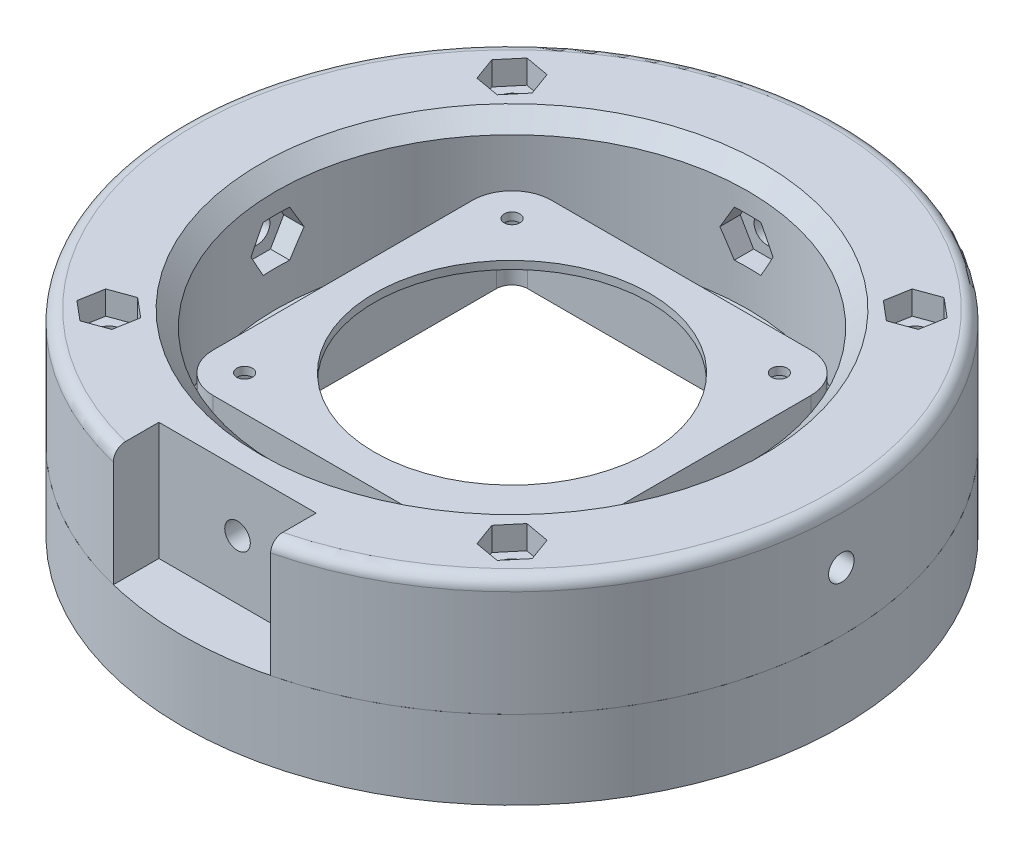
from build123d import *

# Parameters (mm, degrees)
SKETCH1_R               = 41.9
TOP_PART_DEPTH          = 15
SKETCH2_R               = 30
CUT_EXTRUDE1_DEPTH      = 20
FILLET1_R               = 1.5
CHAMFER1_SIZE           = 2
SKETCH8_7_R             = 1.625
CUT_EXTRUDE8_DEPTH      = 3
SKETCH8_R               = 1.625
CUT_EXTRUDE7_DEPTH      = 62.124626857
CUT_EXTRUDE11_DEPTH     = 62.124626857
SKETCH15_R              = 1.625
CUT_EXTRUDE14_DEPTH     = 10
CUT_EXTRUDE15_DEPTH     = 10
CIRPATTERN1_COUNT       = 4
CIRPATTERN2_COUNT       = 4
SKETCH3_R               = 41.9
BOTTOM_PART_DEPTH       = 20
SKETCH6_R               = 37.9
CUT_EXTRUDE3_DEPTH      = 63.076324134
SKETCH_1_W              = 43
SKETCH_1_H              = 43
EXTRUDE_1_DEPTH         = 8
FILLET_1_R              = 5
CUT_EXTRUDE4_DEPTH      = 63.076324134
CUT_EXTRUDE4_DEPTH_BACK = 63.076324134
SKETCH7_R               = 17.5
SKETCH7_R_2             = 1
SKETCH12_W              = 39.5
SKETCH12_H              = 39.5
CUT_EXTRUDE10_DEPTH     = 8.5
FILLET3_R               = 2
SKETCH17_R              = 1.625
CUT_EXTRUDE16_DEPTH     = 63.076324134
SKETCH18_R              = 3
CUT_EXTRUDE17_DEPTH     = 63.076324134
SKETCH19_R              = 2.75
BOSS_EXTRUDE1_DEPTH     = 18.5
SKETCH20_W              = 87.79908129
SKETCH20_H              = 93.09964502
CUT_EXTRUDE18_DEPTH     = 10
SKETCH21_W              = 20
SKETCH21_H              = 8.651798588
CUT_EXTRUDE19_DEPTH     = 15


with BuildPart() as part:
    # Sketch1 → Top-Part (new body)
    with BuildSketch(Plane(origin=(0, 0, 0), x_dir=(1, 0, 0), z_dir=(0, 1, 0))):
        with Locations(Location((0, 0, 0), (0, 0, 270))):
            Circle(SKETCH1_R)
    extrude(amount=TOP_PART_DEPTH)

    # Sketch2 → Cut-Extrude1 (cut)
    with BuildSketch(Plane(origin=(0, 15, 0), x_dir=(1, 0, 0), z_dir=(0, 1, 0))):
        with Locations(Location((0, 0, 0), (0, 0, 270))):
            Circle(SKETCH2_R)
    extrude(amount=-CUT_EXTRUDE1_DEPTH, mode=Mode.SUBTRACT)

    # Fillet1
    fillet1_edges = [part.edges().sort_by_distance(p)[0] for p in [
        (0, 15, -41.9),
    ]]
    fillet(fillet1_edges, radius=FILLET1_R)

    # Chamfer1
    chamfer1_edges = [part.edges().sort_by_distance(p)[0] for p in [
        (0, 15, -30),
    ]]
    chamfer(chamfer1_edges, length=CHAMFER1_SIZE)

    # Sketch8<7> → Cut-Extrude8 (cut)
    # profile 1 of 4: a face of its own
    with BuildSketch(Plane(origin=(0, 15, 0), x_dir=(1, 0, 0), z_dir=(0, 1, 0))):
        Polygon((25.083213555, 22.516777398), (28.056316743, 23.598898462), (28.605724005, 26.714741882), (26.182028081, 28.748464238), (23.208924893, 27.666343174), (22.659517631, 24.550499754), align=None)
        with Locations(Location((25.632620818, 25.632620818, 0), (0, 0, 270))):
            Circle(SKETCH8_7_R, mode=Mode.SUBTRACT)
    # profile 2 of 4: a face of its own
    with BuildSketch(Plane(origin=(0, 15, 0), x_dir=(1, 0, 0), z_dir=(0, 1, 0))):
        Polygon((-22.516777398, 25.083213555), (-23.598898462, 28.056316743), (-26.714741882, 28.605724005), (-28.748464238, 26.182028081), (-27.666343174, 23.208924893), (-24.550499754, 22.659517631), align=None)
        with Locations(Location((-25.632620818, 25.632620818, 0), (0, 0, 270))):
            Circle(SKETCH8_7_R, mode=Mode.SUBTRACT)
    # profile 3 of 4: a face of its own
    with BuildSketch(Plane(origin=(0, 15, 0), x_dir=(1, 0, 0), z_dir=(0, 1, 0))):
        Polygon((22.516777398, -25.083213555), (23.598898462, -28.056316743), (26.714741882, -28.605724005), (28.748464238, -26.182028081), (27.666343174, -23.208924893), (24.550499754, -22.659517631), align=None)
        with Locations(Location((25.632620818, -25.632620818, 0), (0, 0, 270))):
            Circle(SKETCH8_7_R, mode=Mode.SUBTRACT)
    # profile 4 of 4: a face of its own
    with BuildSketch(Plane(origin=(0, 15, 0), x_dir=(1, 0, 0), z_dir=(0, 1, 0))):
        Polygon((-25.083213555, -22.516777398), (-28.056316743, -23.598898462), (-28.605724005, -26.714741882), (-26.182028081, -28.748464238), (-23.208924893, -27.666343174), (-22.659517631, -24.550499754), align=None)
        with Locations(Location((-25.632620818, -25.632620818, 0), (0, 0, 270))):
            Circle(SKETCH8_7_R, mode=Mode.SUBTRACT)
    extrude(amount=-CUT_EXTRUDE8_DEPTH, mode=Mode.SUBTRACT)

    # Sketch8 → Cut-Extrude7 (cut, through all)
    with BuildSketch(Plane(origin=(0, 15, 0), x_dir=(1, 0, 0), z_dir=(0, 1, 0))):
        with Locations(Location((-25.632620818, 25.632620818, 0), (0, 0, 270))):
            Circle(SKETCH8_R)
        with Locations(Location((25.632620818, 25.632620818, 0), (0, 0, 270))):
            Circle(SKETCH8_R)
        with Locations(Location((25.632620818, -25.632620818, 0), (0, 0, 270))):
            Circle(SKETCH8_R)
        with Locations(Location((-25.632620818, -25.632620818, 0), (0, 0, 270))):
            Circle(SKETCH8_R)
    extrude(amount=-CUT_EXTRUDE7_DEPTH, mode=Mode.SUBTRACT)

    # Sketch13 → Cut-Extrude11 (cut, through all)
    with BuildSketch(Plane.XZ):
        with BuildLine():
            Line((-10, 35.519149765), (-10, 40.689187753))
            ThreePointArc((-10, 40.689187753), (0, 41.9), (10, 40.689187753))
            Line((10, 40.689187753), (10, 35.519149765))
            ThreePointArc((10, 35.519149765), (0, 36.9), (-10, 35.519149765))
        make_face()
    extrude(amount=-CUT_EXTRUDE11_DEPTH, mode=Mode.SUBTRACT)

    # Sketch15 → Cut-Extrude14 (cut, symmetric)
    with BuildSketch(Plane.XY.offset(32.4)):
        with Locations(Location((0, 7.5, 0), (0, 0, 180))):
            Circle(SKETCH15_R)
    cut_extrude14 = extrude(amount=CUT_EXTRUDE14_DEPTH, both=True, mode=Mode.SUBTRACT)

    # Sketch16 → Cut-Extrude15 (cut)
    with BuildSketch(Plane.XY.offset(32.4)):
        Polygon((3.377499075, 7.5), (1.688749537, 10.425), (-1.688749537, 10.425), (-3.377499075, 7.5), (-1.688749537, 4.575), (1.688749537, 4.575), align=None)
    cut_extrude15 = extrude(amount=-CUT_EXTRUDE15_DEPTH, mode=Mode.SUBTRACT)

    # CirPattern1: Cut-Extrude14 ×4 about axis
    cirpattern1_axis = Axis((0, 0, 0), (0, 1, 0))
    for i in range(1, CIRPATTERN1_COUNT):
        add(cut_extrude14.rotate(cirpattern1_axis, i * 360 / CIRPATTERN1_COUNT), mode=Mode.SUBTRACT)

    # CirPattern2: Cut-Extrude15 ×4 about axis
    cirpattern2_axis = Axis((0, 0, 0), (0, 1, 0))
    for i in range(1, CIRPATTERN2_COUNT):
        add(cut_extrude15.rotate(cirpattern2_axis, i * 360 / CIRPATTERN2_COUNT), mode=Mode.SUBTRACT)

    # Sketch21 → Cut-Extrude19 (cut)
    with BuildSketch(Plane(origin=(0, 15, 0), x_dir=(1, 0, 0), z_dir=(0, 1, 0))):
        with Locations((0, -39.225899294)):
            Rectangle(SKETCH21_W, SKETCH21_H)
    extrude(amount=-CUT_EXTRUDE19_DEPTH, mode=Mode.SUBTRACT)


with BuildPart() as body_2:
    # Sketch3 → Bottom-Part (new body)
    with BuildSketch(Plane.XZ):
        with Locations(Location((0, 0, 0), (0, 0, 270))):
            Circle(SKETCH3_R)
    extrude(amount=BOTTOM_PART_DEPTH)

    # Sketch6 → Cut-Extrude3 (cut, through all)
    with BuildSketch(Plane(origin=(0, -1.5, 0), x_dir=(1, 0, 0), z_dir=(0, 1, 0))):
        with Locations(Location((0, 0, 0), (0, 0, 270))):
            Circle(SKETCH6_R)
    extrude(amount=-CUT_EXTRUDE3_DEPTH, mode=Mode.SUBTRACT)

    # ｽｹｯﾁ1 → ﾎﾞｽ - 押し出し1 (add)
    with BuildSketch(Plane(origin=(0, 0, 0), x_dir=(1, 0, 0), z_dir=(0, 1, 0))):
        Rectangle(SKETCH_1_W, SKETCH_1_H)
    extrude(amount=EXTRUDE_1_DEPTH)

    # ﾌｨﾚｯﾄ1
    fillet_1_edges = [body_2.edges().sort_by_distance(p)[0] for p in [
        (-21.5, 4, -21.5),
        (-21.5, 4, 21.5),
        (21.5, 4, 21.5),
        (21.5, 4, -21.5),
    ]]
    fillet(fillet_1_edges, radius=FILLET_1_R)

    # Sketch7 → Cut-Extrude4 (cut, two sides: drawn at the far end of the back side and taken through both)
    with BuildSketch(Plane(origin=(0, -1.5, 0), x_dir=(1, 0, 0), z_dir=(0, 1, 0)).offset(-CUT_EXTRUDE4_DEPTH_BACK)):
        with Locations(Location((0, 0, 0), (0, 0, 270))):
            Circle(SKETCH7_R)
        with Locations(Location((17, -17, 0), (0, 0, 270))):
            Circle(SKETCH7_R_2)
        with Locations(Location((-17, -17, 0), (0, 0, 270))):
            Circle(SKETCH7_R_2)
        with Locations(Location((-17, 17, 0), (0, 0, 270))):
            Circle(SKETCH7_R_2)
        with Locations(Location((17, 17, 0), (0, 0, 270))):
            Circle(SKETCH7_R_2)
    extrude(amount=CUT_EXTRUDE4_DEPTH + CUT_EXTRUDE4_DEPTH_BACK, mode=Mode.SUBTRACT)

    # Sketch12 → Cut-Extrude10 (cut)
    with BuildSketch(Plane.XZ.offset(1.5)):
        Rectangle(SKETCH12_W, SKETCH12_H)
    extrude(amount=-CUT_EXTRUDE10_DEPTH, mode=Mode.SUBTRACT)

    # Fillet3
    fillet3_edges = [body_2.edges().sort_by_distance(p)[0] for p in [
        (-19.75, 2.75, -19.75),
        (-19.75, 2.75, 19.75),
        (19.75, 2.75, 19.75),
        (19.75, 2.75, -19.75),
    ]]
    fillet(fillet3_edges, radius=FILLET3_R)

    # Sketch17 → Cut-Extrude16 (cut, through all)
    with BuildSketch(Plane.XZ.offset(1.5)):
        with Locations(Location((25.632620818, -25.632620818, 0), (0, 0, 270))):
            Circle(SKETCH17_R)
        with Locations(Location((-25.632620818, -25.632620818, 0), (0, 0, 270))):
            Circle(SKETCH17_R)
        with Locations(Location((25.632620818, 25.632620818, 0), (0, 0, 270))):
            Circle(SKETCH17_R)
        with Locations(Location((-25.632620818, 25.632620818, 0), (0, 0, 270))):
            Circle(SKETCH17_R)
    extrude(amount=-CUT_EXTRUDE16_DEPTH, mode=Mode.SUBTRACT)

    # Sketch18 → Cut-Extrude17 (cut, through all)
    with BuildSketch(Plane.XZ.offset(1.5)):
        with Locations((-25.632620818, 25.632620818)):
            Circle(SKETCH18_R)
        with Locations((25.632620818, 25.632620818)):
            Circle(SKETCH18_R)
        with Locations((25.632620818, -25.632620818)):
            Circle(SKETCH18_R)
        with Locations((-25.632620818, -25.632620818)):
            Circle(SKETCH18_R)
    extrude(amount=CUT_EXTRUDE17_DEPTH, mode=Mode.SUBTRACT)

    # Sketch19 → Boss-Extrude1 (add)
    # profile 1 of 4: a face of its own
    with BuildSketch(Plane.XZ.offset(1.5)):
        with BuildLine():
            Line((-6, 33), (-6, 37.422052322))
            ThreePointArc((-6, 37.422052322), (0, 37.9), (6, 37.422052322))
            Line((6, 37.422052322), (6, 33))
            ThreePointArc((6, 33), (0, 27), (-6, 33))
        make_face()
        with Locations(Location((0, 33, 0), (0, 0, 270))):
            Circle(SKETCH19_R, mode=Mode.SUBTRACT)
    # profile 2 of 4: a face of its own
    with BuildSketch(Plane.XZ.offset(1.5)):
        with BuildLine():
            Line((33, 6), (37.422052322, 6))
            ThreePointArc((37.422052322, 6), (37.9, 0), (37.422052322, -6))
            Line((37.422052322, -6), (33, -6))
            ThreePointArc((33, -6), (27, 0), (33, 6))
        make_face()
        with Locations(Location((33, 0, 0), (0, 0, 270))):
            Circle(SKETCH19_R, mode=Mode.SUBTRACT)
    # profile 3 of 4: a face of its own
    with BuildSketch(Plane.XZ.offset(1.5)):
        with BuildLine():
            Line((6, -33), (6, -37.422052322))
            ThreePointArc((6, -37.422052322), (0, -37.9), (-6, -37.422052322))
            Line((-6, -37.422052322), (-6, -33))
            ThreePointArc((-6, -33), (0, -27), (6, -33))
        make_face()
        with Locations(Location((0, -33, 0), (0, 0, 270))):
            Circle(SKETCH19_R, mode=Mode.SUBTRACT)
    # profile 4 of 4: a face of its own
    with BuildSketch(Plane.XZ.offset(1.5)):
        with BuildLine():
            Line((-33, -6), (-37.422052322, -6))
            ThreePointArc((-37.422052322, -6), (-37.9, 0), (-37.422052322, 6))
            Line((-37.422052322, 6), (-33, 6))
            ThreePointArc((-33, 6), (-27, 0), (-33, -6))
        make_face()
        with Locations(Location((-33, 0, 0), (0, 0, 270))):
            Circle(SKETCH19_R, mode=Mode.SUBTRACT)
    extrude(amount=BOSS_EXTRUDE1_DEPTH)

    # Sketch20 → Cut-Extrude18 (cut)
    with BuildSketch(Plane.XZ.offset(20)):
        Rectangle(SKETCH20_W, SKETCH20_H)
    extrude(amount=-CUT_EXTRUDE18_DEPTH, mode=Mode.SUBTRACT)


solid = Compound([part.part, body_2.part])
